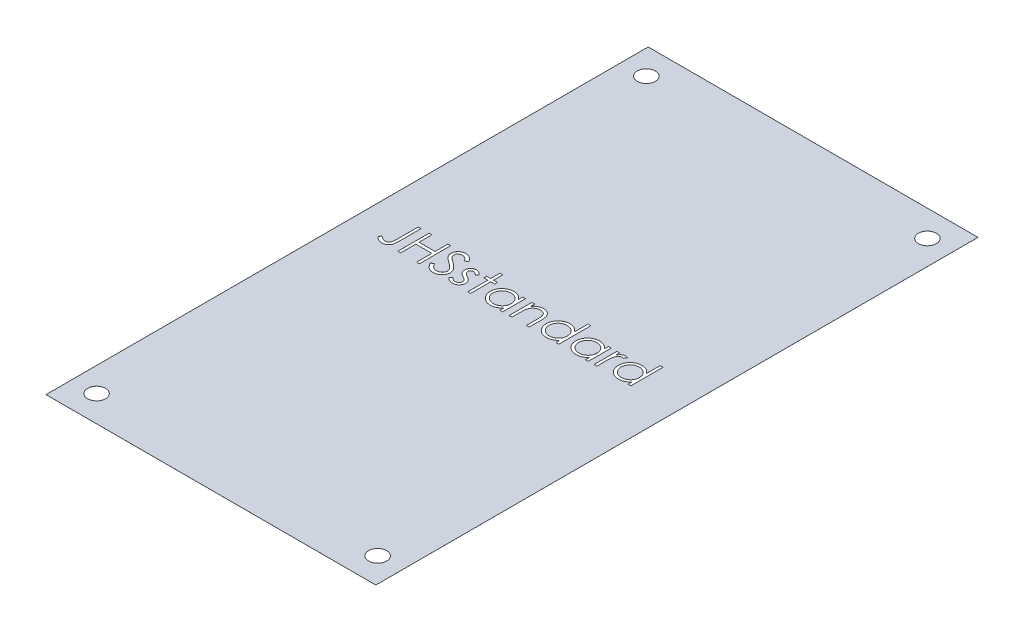
from build123d import *

# Parameters (mm, degrees)
SKETCH2_W           = 67.056
SKETCH2_H           = 122.428
BOSS_EXTRUDE1_DEPTH = 0.00254
SKETCH3_R           = 1.8288
CUT_EXTRUDE1_DEPTH  = 70.794559863
CUT_EXTRUDE2_DEPTH  = 2.54


with BuildPart() as part:
    # Sketch2 → Boss-Extrude1 (new body)
    with BuildSketch(Plane(origin=(0, 0, 0), x_dir=(1, 0, 0), z_dir=(0, 1, 0))):
        Rectangle(SKETCH2_W, SKETCH2_H)
    extrude(amount=BOSS_EXTRUDE1_DEPTH)

    # Sketch3 → Cut-Extrude1 (cut, through all)
    with BuildSketch(Plane(origin=(0, 0.00254, 0), x_dir=(1, 0, 0), z_dir=(0, 1, 0))):
        with Locations(Location((-28.575, 55.88, 0), (0, 0, 270))):
            Circle(SKETCH3_R)
        with Locations(Location((28.575, 55.88, 0), (0, 0, 270))):
            Circle(SKETCH3_R)
        with Locations(Location((28.575, -55.88, 0), (0, 0, 270))):
            Circle(SKETCH3_R)
        with Locations(Location((-28.575, -55.88, 0), (0, 0, 270))):
            Circle(SKETCH3_R)
    extrude(amount=-CUT_EXTRUDE1_DEPTH, mode=Mode.SUBTRACT)

    # Sketch5 → Cut-Extrude2 (cut)
    # profile 1 of 11: a face of its own
    with BuildSketch(Plane(origin=(0, 0.00254, 0), x_dir=(1, 0, 0), z_dir=(0, 1, 0))):
        with BuildLine():
            Line((-25.204522376, 6.142447779), (-24.634650581, 6.142447779))
            Line((-24.634650581, 6.142447779), (-24.634650581, 1.854416929))
            add(Edge.make_bspline(
                [(-24.634650581, 1.854416929), (-24.635220119, 1.775123262), (-24.636313702, 1.622869745), (-24.64232699, 1.403569963), (-24.653454871, 1.203326004), (-24.669665536, 1.021682535), (-24.691292245, 0.859208614), (-24.716040967, 0.714648836), (-24.745999902, 0.589209698), (-24.791114777, 0.448356981), (-24.865090369, 0.293881792), (-24.97642771, 0.127048876), (-25.114735783, -0.018880312), (-25.274939086, -0.145613113), (-25.458437801, -0.246591232), (-25.661453142, -0.319081341), (-25.882735379, -0.363297038), (-26.036222521, -0.367966838), (-26.11529962, -0.370372734)],
                knots=[0, 0, 0, 0, 1.237770943, 2.376671248, 3.424123796, 4.367912054, 5.222547132, 5.982086412, 6.656319012, 7.234008312, 8.288027371, 9.317870876, 10.352700517, 11.413286737, 12.494591526, 13.606319346, 14.766767577, 16, 16, 16, 16], degree=3))
            add(Edge.make_bspline(
                [(-26.11529962, -0.370372734), (-26.176909784, -0.3684122), (-26.300873515, -0.364467477), (-26.485369515, -0.332315226), (-26.669341671, -0.282756119), (-26.853766443, -0.210179981), (-27.042287495, -0.111472681), (-27.237458096, 0.017676915), (-27.441788742, 0.177028398), (-27.576378418, 0.298654022), (-27.646830068, 0.362319574)],
                knots=[0, 0, 0, 0, 0.848567217, 1.707373443, 2.573483905, 3.470863513, 4.432650262, 5.500696352, 6.691726801, 8, 8, 8, 8], degree=3))
            Line((-27.646830068, 0.362319574), (-27.311012761, 0.850781112))
            add(Edge.make_bspline(
                [(-27.311012761, 0.850781112), (-27.2335379, 0.797355122), (-27.087255261, 0.696479886), (-26.872254347, 0.566710197), (-26.681759513, 0.455448825), (-26.557149022, 0.398748261), (-26.499454267, 0.372495856)],
                knots=[0, 0, 0, 0, 1.196737151, 2.259595785, 3.194191475, 4, 4, 4, 4], degree=3))
            add(Edge.make_bspline(
                [(-26.499454267, 0.372495856), (-26.464467016, 0.35878084), (-26.395849226, 0.331882641), (-26.29093801, 0.301863654), (-26.186625586, 0.285458139), (-26.117469198, 0.28240772), (-26.083498738, 0.280909317)],
                knots=[0, 0, 0, 0, 1.051806502, 2.062826769, 3.048436908, 4, 4, 4, 4], degree=3))
            add(Edge.make_bspline(
                [(-26.083498738, 0.280909317), (-26.039624251, 0.282764851), (-25.952900566, 0.286432556), (-25.826873034, 0.318816241), (-25.706299177, 0.368245372), (-25.59550137, 0.440619577), (-25.493383596, 0.526673726), (-25.409123041, 0.630733913), (-25.338878897, 0.746060769), (-25.296606597, 0.855228979), (-25.269673939, 0.954790865), (-25.252580416, 1.046290983), (-25.237633132, 1.153263951), (-25.224603745, 1.275837457), (-25.216975634, 1.414256902), (-25.208417153, 1.568115847), (-25.205323323, 1.737802202), (-25.204797505, 1.8561135), (-25.204522376, 1.918018692)],
                knots=[0, 0, 0, 0, 0.997221856, 1.971139923, 2.944579524, 3.951425367, 4.971190333, 5.972282193, 6.985401279, 8.033996657, 8.624075553, 9.332086008, 10.151144245, 11.082816738, 12.137127781, 13.306538797, 14.590673636, 16, 16, 16, 16], degree=3))
            Line((-25.204522376, 1.918018692), (-25.204522376, 6.142447779))
        make_face()
    # profile 2 of 11: a face of its own
    with BuildSketch(Plane(origin=(0, 0.00254, 0), x_dir=(1, 0, 0), z_dir=(0, 1, 0))):
        Polygon((-23.006445453, 6.142447779), (-22.436573658, 6.142447779), (-22.436573658, 3.537319574), (-19.180163402, 3.537319574), (-19.180163402, 6.142447779), (-18.610291607, 6.142447779), (-18.610291607, -0.207552221), (-19.180163402, -0.207552221), (-19.180163402, 2.886037522), (-22.436573658, 2.886037522), (-22.436573658, -0.207552221), (-23.006445453, -0.207552221), align=None)
    # profile 3 of 11: a face of its own
    with BuildSketch(Plane(origin=(0, 0.00254, 0), x_dir=(1, 0, 0), z_dir=(0, 1, 0))):
        with BuildLine():
            Line((-17.63336853, 1.017417731), (-17.096569652, 1.33924265))
            add(Edge.make_bspline(
                [(-17.096569652, 1.33924265), (-17.046643707, 1.255668695), (-16.950987524, 1.095544221), (-16.791418629, 0.879176062), (-16.62607749, 0.695276149), (-16.453739699, 0.544914304), (-16.275457194, 0.426534181), (-16.090066125, 0.342710132), (-15.898191239, 0.29042972), (-15.767610163, 0.284079563), (-15.702419011, 0.280909317)],
                knots=[0, 0, 0, 0, 1.272034388, 2.437168799, 3.508375237, 4.49857839, 5.41946034, 6.295179144, 7.148887113, 8, 8, 8, 8], degree=3))
            add(Edge.make_bspline(
                [(-15.702419011, 0.280909317), (-15.646744278, 0.282459937), (-15.53636899, 0.285534045), (-15.373877492, 0.315072072), (-15.216067651, 0.36045122), (-15.066191979, 0.425440624), (-14.926318507, 0.50406902), (-14.803660646, 0.599039942), (-14.697622697, 0.705368344), (-14.610883304, 0.82399116), (-14.54433524, 0.951566558), (-14.493186773, 1.082514356), (-14.464802139, 1.218891615), (-14.460526315, 1.310713455), (-14.45836853, 1.357051144)],
                knots=[0, 0, 0, 0, 1.095163259, 2.171163733, 3.241058638, 4.321873601, 5.38011039, 6.391990106, 7.366004449, 8.327778327, 9.272591725, 10.192022065, 11.087607919, 12, 12, 12, 12], degree=3))
            add(Edge.make_bspline(
                [(-14.45836853, 1.357051144), (-14.461043351, 1.409920971), (-14.466480871, 1.517397605), (-14.512439413, 1.675965546), (-14.584737332, 1.832887781), (-14.651435272, 1.929954362), (-14.686062841, 1.98034842)],
                knots=[0, 0, 0, 0, 0.938893495, 1.908633276, 2.914225137, 4, 4, 4, 4], degree=3))
            add(Edge.make_bspline(
                [(-14.686062841, 1.98034842), (-14.714493812, 2.016719085), (-14.77418108, 2.093074748), (-14.876792568, 2.206731104), (-14.997199661, 2.323967379), (-15.131281825, 2.449260239), (-15.283923286, 2.576782385), (-15.450343205, 2.712614832), (-15.634790492, 2.851591979), (-15.76414815, 2.94479649), (-15.830894572, 2.992888484)],
                knots=[0, 0, 0, 0, 0.722233717, 1.516239348, 2.393582979, 3.351407094, 4.387010283, 5.505090956, 6.712668013, 8, 8, 8, 8], degree=3))
            add(Edge.make_bspline(
                [(-15.830894572, 2.992888484), (-15.897703822, 3.040474636), (-16.025438021, 3.131455734), (-16.20407002, 3.26648265), (-16.363807832, 3.38993367), (-16.503941476, 3.502970949), (-16.624409316, 3.605609818), (-16.726160647, 3.69686465), (-16.806603458, 3.779203396), (-16.851335726, 3.832618402), (-16.871419411, 3.856600423)],
                knots=[0, 0, 0, 0, 1.452282411, 2.77665338, 3.964542531, 5.026858415, 5.96415736, 6.766646006, 7.446254459, 8, 8, 8, 8], degree=3))
            add(Edge.make_bspline(
                [(-16.871419411, 3.856600423), (-16.899491029, 3.89397659), (-16.954697633, 3.967481838), (-17.027570243, 4.082371223), (-17.089508438, 4.199979147), (-17.138062955, 4.320621644), (-17.178950095, 4.442605015), (-17.206450912, 4.567520847), (-17.223671018, 4.694808626), (-17.225434479, 4.780467406), (-17.226317248, 4.823347218)],
                knots=[0, 0, 0, 0, 1.068054152, 2.10047183, 3.106115577, 4.101338837, 5.06977816, 6.043150881, 7.020423561, 8, 8, 8, 8], degree=3))
            add(Edge.make_bspline(
                [(-17.226317248, 4.823347218), (-17.223949226, 4.890529809), (-17.219263797, 5.02345901), (-17.179638858, 5.217643517), (-17.11709518, 5.403038874), (-17.029474454, 5.577809622), (-16.916521828, 5.737405045), (-16.785809846, 5.883660942), (-16.630123293, 6.006612513), (-16.459303533, 6.114040105), (-16.27232983, 6.198124855), (-16.076403477, 6.261554061), (-15.871213074, 6.297493715), (-15.732233102, 6.302651302), (-15.661713882, 6.305268291)],
                knots=[0, 0, 0, 0, 1.005424448, 1.989358655, 2.955360095, 3.929531133, 4.905563448, 5.876582895, 6.856512386, 7.866279853, 8.892233794, 9.918561126, 10.94386622, 12, 12, 12, 12], degree=3))
            add(Edge.make_bspline(
                [(-15.661713882, 6.305268291), (-15.586885301, 6.302687376), (-15.438075134, 6.29755476), (-15.219182986, 6.25292781), (-15.008434257, 6.179085163), (-14.838901477, 6.095285741), (-14.706217752, 6.011590172), (-14.60503008, 5.935354205), (-14.502491277, 5.847587937), (-14.397774234, 5.74805759), (-14.292653324, 5.635849913), (-14.185567917, 5.511733378), (-14.076267601, 5.376466484), (-14.005953398, 5.279902032), (-13.969906991, 5.2303985)],
                knots=[0, 0, 0, 0, 1.286793592, 2.559021753, 3.825965368, 5.121522368, 5.803751409, 6.523245864, 7.299691795, 8.125521123, 9.008227632, 9.944561021, 10.946284179, 12, 12, 12, 12], degree=3))
            Line((-13.969906991, 5.2303985), (-14.48508127, 4.839883676))
            add(Edge.make_bspline(
                [(-14.48508127, 4.839883676), (-14.516188891, 4.879958872), (-14.576094894, 4.957134328), (-14.667044106, 5.065213715), (-14.752766653, 5.163940756), (-14.837222378, 5.249693203), (-14.915950824, 5.327167074), (-14.992363172, 5.393496918), (-15.065359781, 5.449332641), (-15.157374747, 5.508920243), (-15.272976893, 5.567987042), (-15.418091695, 5.617968941), (-15.569741079, 5.648004553), (-15.673027697, 5.651975821), (-15.725315645, 5.65398624)],
                knots=[0, 0, 0, 0, 1.181633172, 2.275549214, 3.290209073, 4.226197932, 5.078386478, 5.862611352, 6.581680152, 7.217281963, 8.414376989, 9.595101626, 10.782541182, 12, 12, 12, 12], degree=3))
            add(Edge.make_bspline(
                [(-15.725315645, 5.65398624), (-15.790913907, 5.65178787), (-15.917413976, 5.647548521), (-16.097010547, 5.601247976), (-16.258652383, 5.528346601), (-16.397540608, 5.426175141), (-16.513177695, 5.305124197), (-16.59682617, 5.165825417), (-16.647172897, 5.012005915), (-16.653316576, 4.904706053), (-16.656445453, 4.850059958)],
                knots=[0, 0, 0, 0, 1.14458467, 2.207223713, 3.21896685, 4.227309161, 5.202851033, 6.127160689, 7.046193047, 8, 8, 8, 8], degree=3))
            add(Edge.make_bspline(
                [(-16.656445453, 4.850059958), (-16.655732209, 4.816039419), (-16.654304555, 4.747942709), (-16.634393136, 4.647337986), (-16.608812925, 4.546987413), (-16.568277007, 4.447342156), (-16.512314814, 4.346659533), (-16.438826852, 4.243205809), (-16.346274128, 4.136069138), (-16.275377263, 4.066387188), (-16.237945854, 4.029597218)],
                knots=[0, 0, 0, 0, 0.858281714, 1.717966888, 2.583508476, 3.4729293, 4.427298488, 5.488583878, 6.674047936, 8, 8, 8, 8], degree=3))
            add(Edge.make_bspline(
                [(-16.237945854, 4.029597218), (-16.224045935, 4.0171929), (-16.19102291, 3.987723079), (-16.130650874, 3.939477084), (-16.050926083, 3.879963483), (-15.953930375, 3.806326494), (-15.837875304, 3.72090727), (-15.70274811, 3.624798002), (-15.550055043, 3.514878669), (-15.441702424, 3.438029989), (-15.384410197, 3.397395695)],
                knots=[0, 0, 0, 0, 0.420754252, 0.999615792, 1.744751191, 2.668019286, 3.750313428, 4.999500688, 6.413464383, 8, 8, 8, 8], degree=3))
            add(Edge.make_bspline(
                [(-15.384410197, 3.397395695), (-15.315492897, 3.347246372), (-15.182044097, 3.250139157), (-14.992165345, 3.104242137), (-14.820000865, 2.961552614), (-14.664946195, 2.822981813), (-14.525469519, 2.689580844), (-14.403118225, 2.559744788), (-14.296645634, 2.434403821), (-14.18202048, 2.273707862), (-14.064894151, 2.076347895), (-13.964307416, 1.834543091), (-13.900882986, 1.591798338), (-13.89258895, 1.428645363), (-13.888496735, 1.348146897)],
                knots=[0, 0, 0, 0, 1.163667725, 2.253281268, 3.268753668, 4.215851969, 5.092017293, 5.902905408, 6.650798638, 7.335211899, 8.59617414, 9.77448103, 10.901945474, 12, 12, 12, 12], degree=3))
            add(Edge.make_bspline(
                [(-13.888496735, 1.348146897), (-13.889688971, 1.291217578), (-13.892050292, 1.178464468), (-13.919193664, 1.012901685), (-13.958962199, 0.852099965), (-14.018901181, 0.698046946), (-14.092058911, 0.547924305), (-14.184889103, 0.405669972), (-14.292490188, 0.268135506), (-14.415922876, 0.138988314), (-14.550989013, 0.020431644), (-14.693743716, -0.085031081), (-14.84442064, -0.172966468), (-15.002202386, -0.244722996), (-15.167125197, -0.300845235), (-15.339133605, -0.341508583), (-15.518511147, -0.366465373), (-15.64043202, -0.36905574), (-15.702419011, -0.370372734)],
                knots=[0, 0, 0, 0, 0.983748083, 1.948392443, 2.894712957, 3.844097841, 4.80183111, 5.778335162, 6.776009319, 7.81870978, 8.863265674, 9.881300176, 10.883814829, 11.87499822, 12.874611388, 13.892143829, 14.928324115, 16, 16, 16, 16], degree=3))
            add(Edge.make_bspline(
                [(-15.702419011, -0.370372734), (-15.750380276, -0.369445305), (-15.845698783, -0.367602126), (-15.986685986, -0.351307517), (-16.124824955, -0.3282532), (-16.258382295, -0.291651674), (-16.389078742, -0.247243444), (-16.516345868, -0.192563897), (-16.640245351, -0.127036975), (-16.761471537, -0.052116002), (-16.879716111, 0.035074478), (-16.993870003, 0.136626393), (-17.107678668, 0.249738952), (-17.217782944, 0.377483831), (-17.326409935, 0.51779721), (-17.431417906, 0.671991871), (-17.534980451, 0.839227927), (-17.599959943, 0.956911726), (-17.63336853, 1.017417731)],
                knots=[0, 0, 0, 0, 0.915332311, 1.819136955, 2.706846663, 3.586547465, 4.459518054, 5.340707479, 6.227863349, 7.133153174, 8.059268498, 9.028702269, 10.047606654, 11.120612155, 12.245963614, 13.433783089, 14.680604001, 16, 16, 16, 16], degree=3))
        make_face()
    # profile 4 of 11: a face of its own
    with BuildSketch(Plane(origin=(0, 0.00254, 0), x_dir=(1, 0, 0), z_dir=(0, 1, 0))):
        with BuildLine():
            Line((-10.550676222, 3.854056352), (-10.93737494, 3.455909317))
            add(Edge.make_bspline(
                [(-10.93737494, 3.455909317), (-10.970740568, 3.494577454), (-11.035065571, 3.56912507), (-11.137085543, 3.668796605), (-11.238728367, 3.752502194), (-11.338602643, 3.823172721), (-11.439219788, 3.876601887), (-11.539399054, 3.915599708), (-11.639244165, 3.939732984), (-11.705984543, 3.942843465), (-11.738757152, 3.944370856)],
                knots=[0, 0, 0, 0, 1.26578478, 2.440284043, 3.530471711, 4.527705817, 5.468200915, 6.346673037, 7.188140097, 8, 8, 8, 8], degree=3))
            add(Edge.make_bspline(
                [(-11.738757152, 3.944370856), (-11.77892433, 3.942420729), (-11.857967653, 3.938583156), (-11.971225924, 3.900277361), (-12.076364915, 3.841478649), (-12.167364007, 3.758078505), (-12.244448798, 3.662349046), (-12.300716477, 3.555312856), (-12.33512619, 3.440199977), (-12.339489061, 3.360317235), (-12.341701863, 3.319801545)],
                knots=[0, 0, 0, 0, 0.99966794, 1.967205029, 2.953328237, 3.988086729, 5.028030931, 6.008226631, 6.989793394, 8, 8, 8, 8], degree=3))
            add(Edge.make_bspline(
                [(-12.341701863, 3.319801545), (-12.339686532, 3.283131122), (-12.335661552, 3.209893649), (-12.304371148, 3.101856502), (-12.254539846, 2.996524447), (-12.207966779, 2.932003174), (-12.183969491, 2.898757875)],
                knots=[0, 0, 0, 0, 0.960159726, 1.917612774, 2.927026955, 4, 4, 4, 4], degree=3))
            add(Edge.make_bspline(
                [(-12.183969491, 2.898757875), (-12.169521438, 2.881005843), (-12.138770579, 2.843222881), (-12.081060844, 2.790783033), (-12.015705732, 2.732830663), (-11.937110988, 2.674888116), (-11.848662694, 2.613870558), (-11.74844285, 2.552180974), (-11.639631963, 2.485116946), (-11.561731421, 2.442582041), (-11.521239123, 2.420472618)],
                knots=[0, 0, 0, 0, 0.66740084, 1.420478572, 2.27185888, 3.217733974, 4.268547843, 5.408967954, 6.65319498, 8, 8, 8, 8], degree=3))
            add(Edge.make_bspline(
                [(-11.521239123, 2.420472618), (-11.471865919, 2.392814009), (-11.376493146, 2.339386683), (-11.240979125, 2.256456221), (-11.117994065, 2.174030637), (-11.006495925, 2.09299144), (-10.908630072, 2.011071237), (-10.821427241, 1.931410021), (-10.747062493, 1.851600848), (-10.705417511, 1.795842198), (-10.685511959, 1.769190567)],
                knots=[0, 0, 0, 0, 1.27191281, 2.456916733, 3.569705269, 4.599008579, 5.553216877, 6.436649441, 7.252746552, 8, 8, 8, 8], degree=3))
            add(Edge.make_bspline(
                [(-10.685511959, 1.769190567), (-10.65247286, 1.715367807), (-10.586718919, 1.608250526), (-10.51767035, 1.431868522), (-10.477646709, 1.244796611), (-10.472090966, 1.116831011), (-10.469265966, 1.051762683)],
                knots=[0, 0, 0, 0, 0.995354457, 1.980940102, 2.973342416, 4, 4, 4, 4], degree=3))
            add(Edge.make_bspline(
                [(-10.469265966, 1.051762683), (-10.470571406, 1.005917231), (-10.473143918, 0.915573762), (-10.491029268, 0.782523428), (-10.521790439, 0.655279302), (-10.563689107, 0.532460714), (-10.620266469, 0.416420924), (-10.686574615, 0.304232301), (-10.766176241, 0.198321683), (-10.857056308, 0.098828141), (-10.956561704, 0.007958285), (-11.062708555, -0.071913745), (-11.175627577, -0.138270043), (-11.294511916, -0.193180026), (-11.419631689, -0.236846723), (-11.551006457, -0.267077315), (-11.688218626, -0.285170753), (-11.781526992, -0.287682589), (-11.829071655, -0.288962478)],
                knots=[0, 0, 0, 0, 1.032770009, 2.035186124, 3.017557409, 3.978232242, 4.952395191, 5.920591857, 6.910227898, 7.931268572, 8.952309245, 9.941945286, 10.918353717, 11.897095711, 12.887975737, 13.898235213, 14.929059601, 16, 16, 16, 16], degree=3))
            add(Edge.make_bspline(
                [(-11.829071655, -0.288962478), (-11.893237816, -0.287161436), (-12.020678555, -0.283584377), (-12.209164188, -0.250009095), (-12.39335185, -0.197766023), (-12.571847702, -0.125709971), (-12.740659937, -0.034722249), (-12.895111758, 0.074248094), (-13.035739697, 0.197601375), (-13.11578285, 0.292149084), (-13.155804427, 0.339422939)],
                knots=[0, 0, 0, 0, 1.013940152, 2.01379169, 3.017749504, 4.037548394, 5.051665909, 6.043208538, 7.021604269, 8, 8, 8, 8], degree=3))
            Line((-13.155804427, 0.339422939), (-12.778009956, 0.769370856))
            add(Edge.make_bspline(
                [(-12.778009956, 0.769370856), (-12.74213715, 0.730627211), (-12.672592291, 0.655516799), (-12.561374369, 0.555505495), (-12.448200312, 0.471683189), (-12.334200238, 0.401572994), (-12.217686638, 0.347551905), (-12.099312453, 0.309599599), (-11.979318455, 0.285207993), (-11.898724008, 0.282344538), (-11.858328466, 0.280909317)],
                knots=[0, 0, 0, 0, 1.179806542, 2.287233372, 3.337373186, 4.324005949, 5.273901747, 6.200048787, 7.097828587, 8, 8, 8, 8], degree=3))
            add(Edge.make_bspline(
                [(-11.858328466, 0.280909317), (-11.803323086, 0.283396385), (-11.6958518, 0.288255699), (-11.541920981, 0.332373851), (-11.39979233, 0.401552478), (-11.276378546, 0.499677573), (-11.171327483, 0.613896969), (-11.095257795, 0.742555443), (-11.047585305, 0.881877086), (-11.041986422, 0.978455692), (-11.039137761, 1.027594013)],
                knots=[0, 0, 0, 0, 1.072336372, 2.095165389, 3.102688358, 4.141489647, 5.156069229, 6.117746104, 7.042326257, 8, 8, 8, 8], degree=3))
            add(Edge.make_bspline(
                [(-11.039137761, 1.027594013), (-11.041108609, 1.068070035), (-11.044999785, 1.147984523), (-11.075558293, 1.263645856), (-11.123841611, 1.373354408), (-11.17138433, 1.43756134), (-11.195598097, 1.470262282)],
                knots=[0, 0, 0, 0, 1.013901739, 2.00181326, 2.98231254, 4, 4, 4, 4], degree=3))
            add(Edge.make_bspline(
                [(-11.195598097, 1.470262282), (-11.210153013, 1.48665501), (-11.241858876, 1.522364293), (-11.300016242, 1.573935508), (-11.369651906, 1.629521774), (-11.451549059, 1.688180513), (-11.545872797, 1.749137983), (-11.653005417, 1.812074379), (-11.771479276, 1.879978968), (-11.855245993, 1.925008914), (-11.899033594, 1.948547538)],
                knots=[0, 0, 0, 0, 0.615000592, 1.339693406, 2.178160186, 3.116406724, 4.166410947, 5.330106347, 6.604359322, 8, 8, 8, 8], degree=3))
            add(Edge.make_bspline(
                [(-11.899033594, 1.948547538), (-11.946289641, 1.974925677), (-12.037934197, 2.026081307), (-12.167741425, 2.105757624), (-12.284848768, 2.186796822), (-12.392074096, 2.264652973), (-12.486709063, 2.343430972), (-12.568380855, 2.423218271), (-12.640304975, 2.500797103), (-12.680123851, 2.555765055), (-12.69914377, 2.582021096)],
                knots=[0, 0, 0, 0, 1.262093308, 2.447601706, 3.550203992, 4.582594899, 5.537233252, 6.418365656, 7.244515135, 8, 8, 8, 8], degree=3))
            add(Edge.make_bspline(
                [(-12.69914377, 2.582021096), (-12.732037858, 2.634899569), (-12.797837529, 2.740674994), (-12.861727948, 2.917224002), (-12.9056446, 3.103088606), (-12.909567794, 3.231334756), (-12.911573658, 3.29690491)],
                knots=[0, 0, 0, 0, 0.985009483, 1.970363186, 2.962279964, 4, 4, 4, 4], degree=3))
            add(Edge.make_bspline(
                [(-12.911573658, 3.29690491), (-12.910604475, 3.339768132), (-12.908707647, 3.42365753), (-12.893569153, 3.546917961), (-12.866007049, 3.664026755), (-12.831435975, 3.776742635), (-12.783388238, 3.882882148), (-12.725973525, 3.983860703), (-12.658504911, 4.079538726), (-12.58077494, 4.168444408), (-12.495310027, 4.249197043), (-12.402972373, 4.319588839), (-12.305838679, 4.379653226), (-12.203497689, 4.43002716), (-12.09496626, 4.468129669), (-11.981003016, 4.494359496), (-11.861838635, 4.511876792), (-11.780375164, 4.513442674), (-11.738757152, 4.51424265)],
                knots=[0, 0, 0, 0, 1.087655834, 2.128696564, 3.144119009, 4.137814668, 5.115653402, 6.093965665, 7.082169637, 8.081268856, 9.086088321, 10.061021666, 11.022561449, 11.980240094, 12.950172527, 13.934149372, 14.944599409, 16, 16, 16, 16], degree=3))
            add(Edge.make_bspline(
                [(-11.738757152, 4.51424265), (-11.689422979, 4.512239061), (-11.589829177, 4.508194297), (-11.440414355, 4.476071115), (-11.291219578, 4.42321534), (-11.1418615, 4.350215317), (-10.993434261, 4.255751128), (-10.844632249, 4.141579399), (-10.693669108, 4.00845126), (-10.599405512, 3.906671237), (-10.550676222, 3.854056352)],
                knots=[0, 0, 0, 0, 0.845714091, 1.707292901, 2.609013841, 3.555613372, 4.552488639, 5.621697636, 6.770543573, 8, 8, 8, 8], degree=3))
        make_face()
    # profile 5 of 11: a face of its own
    with BuildSketch(Plane(origin=(0, 0.00254, 0), x_dir=(1, 0, 0), z_dir=(0, 1, 0))):
        Polygon((-8.759650581, 6.305268291), (-8.189778786, 6.305268291), (-8.189778786, 4.432832394), (-7.375676222, 4.432832394), (-7.375676222, 3.862960599), (-8.189778786, 3.862960599), (-8.189778786, -0.207552221), (-8.759650581, -0.207552221), (-8.759650581, 3.862960599), (-9.573753145, 3.862960599), (-9.573753145, 4.432832394), (-8.759650581, 4.432832394), align=None)
    # profile 6 of 11: a face of its own
    with BuildSketch(Plane(origin=(0, 0.00254, 0), x_dir=(1, 0, 0), z_dir=(0, 1, 0))):
        with BuildLine():
            Line((-1.676958274, 4.432832394), (-1.676958274, -0.207552221))
            Line((-1.676958274, -0.207552221), (-2.246830068, -0.207552221))
            Line((-2.246830068, -0.207552221), (-2.246830068, 0.595102025))
            add(Edge.make_bspline(
                [(-2.246830068, 0.595102025), (-2.311089874, 0.522458762), (-2.436493693, 0.38069452), (-2.645936865, 0.195488293), (-2.867947702, 0.04240191), (-3.10144867, -0.081241509), (-3.346228911, -0.174118525), (-3.601745813, -0.240133414), (-3.868103604, -0.282576515), (-4.049990019, -0.286814726), (-4.1421626, -0.288962478)],
                knots=[0, 0, 0, 0, 1.074387032, 2.096679803, 3.090159297, 4.057316773, 5.018401886, 5.985159533, 6.978961417, 8, 8, 8, 8], degree=3))
            add(Edge.make_bspline(
                [(-4.1421626, -0.288962478), (-4.224110174, -0.286737488), (-4.385714417, -0.28234971), (-4.6234386, -0.24830953), (-4.852205967, -0.193643974), (-5.072232691, -0.117623789), (-5.282095012, -0.016784298), (-5.483589759, 0.103940538), (-5.675673072, 0.247706044), (-5.85541715, 0.412058609), (-6.020938065, 0.590575229), (-6.166192088, 0.780976435), (-6.287301247, 0.982438901), (-6.388574822, 1.192411909), (-6.466582475, 1.412511834), (-6.520963212, 1.641977553), (-6.554963737, 1.880537752), (-6.559349701, 2.04298803), (-6.561573658, 2.125360439)],
                knots=[0, 0, 0, 0, 1.033919861, 2.038935746, 3.024066025, 3.998881131, 4.97069526, 5.957263378, 6.95902576, 7.993208707, 9.027059324, 10.027763471, 11.009749337, 11.988697705, 12.965288445, 13.950418724, 14.960734635, 16, 16, 16, 16], degree=3))
            add(Edge.make_bspline(
                [(-6.561573658, 2.125360439), (-6.55930041, 2.206030301), (-6.554806321, 2.365510267), (-6.521326908, 2.600058762), (-6.465027792, 2.825970463), (-6.386019554, 3.04251806), (-6.284706293, 3.24996358), (-6.161465335, 3.44845374), (-6.016287781, 3.638535361), (-5.848915556, 3.815738872), (-5.667605331, 3.979424844), (-5.473642347, 4.121681255), (-5.271851537, 4.244538966), (-5.059102932, 4.341881702), (-4.838545471, 4.42063822), (-4.608215648, 4.475126605), (-4.369071783, 4.507234602), (-4.206710462, 4.511884189), (-4.124354107, 4.51424265)],
                knots=[0, 0, 0, 0, 1.020392517, 2.01726096, 2.990465484, 3.961182959, 4.928053699, 5.906110375, 6.912531644, 7.948652711, 8.985773172, 9.998621852, 10.987621588, 11.969261332, 12.953316658, 13.946091881, 14.958173133, 16, 16, 16, 16], degree=3))
            add(Edge.make_bspline(
                [(-4.124354107, 4.51424265), (-4.029648648, 4.511634158), (-3.843935714, 4.506519029), (-3.572286325, 4.463950938), (-3.315302773, 4.392035433), (-3.071001305, 4.294213686), (-2.840259204, 4.164222421), (-2.625260932, 4.000247349), (-2.423756412, 3.803322624), (-2.306952169, 3.652064817), (-2.246830068, 3.574208596)],
                knots=[0, 0, 0, 0, 1.038897134, 2.037228247, 3.008116434, 3.962042015, 4.918381754, 5.904844433, 6.921570401, 8, 8, 8, 8], degree=3))
            Line((-2.246830068, 3.574208596), (-2.246830068, 4.432832394))
            Line((-2.246830068, 4.432832394), (-1.676958274, 4.432832394))
        make_face()
        with BuildLine():
            add(Edge.make_bspline(
                [(-4.116721895, 3.944370856), (-4.200023623, 3.94140697), (-4.364447983, 3.935556731), (-4.605827815, 3.889884819), (-4.836810723, 3.813894197), (-5.056241458, 3.709968462), (-5.260653794, 3.579287755), (-5.443340882, 3.421224673), (-5.605796926, 3.240091805), (-5.742427634, 3.036706547), (-5.853807536, 2.818669154), (-5.932124865, 2.59075053), (-5.983776214, 2.3570615), (-5.989053101, 2.198560627), (-5.991701863, 2.119000263)],
                knots=[0, 0, 0, 0, 1.031046209, 2.035121221, 3.029706178, 4.034933723, 5.034054252, 6.02443088, 7.017295772, 8.038157696, 9.050218397, 10.03989886, 11.016116709, 12, 12, 12, 12], degree=3))
            add(Edge.make_bspline(
                [(-5.991701863, 2.119000263), (-5.988318414, 2.039915354), (-5.981564777, 1.882055523), (-5.933031375, 1.648047905), (-5.851606461, 1.420075571), (-5.740495862, 1.200073483), (-5.601364414, 0.995813758), (-5.440095002, 0.811228107), (-5.255128063, 0.652496997), (-5.0502453, 0.519623113), (-4.831427982, 0.412285397), (-4.601314992, 0.337599165), (-4.364232049, 0.289379478), (-4.203028529, 0.28374707), (-4.121810036, 0.280909317)],
                knots=[0, 0, 0, 0, 0.979072187, 1.954306742, 2.945804271, 3.96968567, 4.997920485, 5.998718438, 6.996577872, 8.005894225, 9.015743152, 10.005417472, 10.995077863, 12, 12, 12, 12], degree=3))
            add(Edge.make_bspline(
                [(-4.121810036, 0.280909317), (-4.039357096, 0.283920966), (-3.875366374, 0.289910837), (-3.633270433, 0.335778275), (-3.398329572, 0.411558809), (-3.173744172, 0.516604368), (-2.964527762, 0.646792714), (-2.776753042, 0.799205579), (-2.61797407, 0.97646707), (-2.483367479, 1.171278635), (-2.377820651, 1.384841828), (-2.300938372, 1.61223386), (-2.255483429, 1.853462646), (-2.249754405, 2.018315771), (-2.246830068, 2.102463804)],
                knots=[0, 0, 0, 0, 1.01762866, 2.023962475, 3.030623092, 4.058876274, 5.077231937, 6.066672613, 7.034107872, 8.005628644, 8.981990164, 9.965428785, 10.961468474, 12, 12, 12, 12], degree=3))
            add(Edge.make_bspline(
                [(-2.246830068, 2.102463804), (-2.248571159, 2.166576725), (-2.251998177, 2.292771243), (-2.278179353, 2.478059739), (-2.319826148, 2.655376642), (-2.378511342, 2.824908378), (-2.455602673, 2.98571762), (-2.548580762, 3.138959014), (-2.65908065, 3.283835554), (-2.785323541, 3.418352269), (-2.92350898, 3.541045993), (-3.069730504, 3.650563973), (-3.225720516, 3.740532175), (-3.388855712, 3.814992767), (-3.559419133, 3.874245796), (-3.738798686, 3.913774898), (-3.925087705, 3.940917195), (-4.052171263, 3.943207514), (-4.116721895, 3.944370856)],
                knots=[0, 0, 0, 0, 1.050140795, 2.067009409, 3.05949893, 4.030605086, 5.00011959, 5.97591094, 6.962425594, 7.979863591, 8.993523472, 9.986985069, 10.967611495, 11.937549037, 12.921786183, 13.919465291, 14.943216303, 16, 16, 16, 16], degree=3))
        make_face(mode=Mode.SUBTRACT)
    # profile 7 of 11: a face of its own
    with BuildSketch(Plane(origin=(0, 0.00254, 0), x_dir=(1, 0, 0), z_dir=(0, 1, 0))):
        with BuildLine():
            Line((-0.374394171, 4.432832394), (0.195477624, 4.432832394))
            Line((0.195477624, 4.432832394), (0.195477624, 3.595833195))
            add(Edge.make_bspline(
                [(0.195477624, 3.595833195), (0.256324476, 3.67174785), (0.374399916, 3.819062885), (0.571040064, 4.012684499), (0.778855426, 4.172242264), (0.996573346, 4.299430576), (1.224489379, 4.395309455), (1.46121424, 4.464553358), (1.708165207, 4.506072976), (1.876103542, 4.511498108), (1.96106256, 4.51424265)],
                knots=[0, 0, 0, 0, 1.12780773, 2.188550248, 3.19190651, 4.159438251, 5.104880172, 6.052711206, 7.014878035, 8, 8, 8, 8], degree=3))
            add(Edge.make_bspline(
                [(1.96106256, 4.51424265), (2.046933853, 4.511076367), (2.215004688, 4.504879187), (2.459712027, 4.455863191), (2.688263756, 4.372142514), (2.89984495, 4.257457757), (3.090575751, 4.114843155), (3.258079411, 3.948694894), (3.396624159, 3.757585143), (3.489510804, 3.580287417), (3.550698764, 3.423009176), (3.589220291, 3.288304358), (3.621933643, 3.138229998), (3.6502941, 2.973239601), (3.669484003, 2.79217717), (3.684619304, 2.595784928), (3.695466363, 2.384126492), (3.695896725, 2.237737896), (3.69611865, 2.162249461)],
                knots=[0, 0, 0, 0, 1.235846778, 2.418850247, 3.575807741, 4.728682307, 5.871620074, 6.994088408, 8.11269785, 9.256955736, 9.865816715, 10.540099792, 11.271859618, 12.076849838, 12.949306005, 13.892391288, 14.913166135, 16, 16, 16, 16], degree=3))
            Line((3.69611865, 2.162249461), (3.69611865, -0.207552221))
            Line((3.69611865, -0.207552221), (3.126246855, -0.207552221))
            Line((3.126246855, -0.207552221), (3.126246855, 1.975260279))
            add(Edge.make_bspline(
                [(3.126246855, 1.975260279), (3.12589632, 2.038438143), (3.125225807, 2.159286645), (3.123110991, 2.332313302), (3.118013199, 2.489224665), (3.110849831, 2.629645603), (3.100365019, 2.753441278), (3.089438245, 2.860863823), (3.076076073, 2.95177685), (3.064169073, 3.006504928), (3.058828986, 3.031049541)],
                knots=[0, 0, 0, 0, 1.430800155, 2.736877192, 3.918605307, 4.986035426, 5.920637409, 6.731861385, 7.431261377, 8, 8, 8, 8], degree=3))
            add(Edge.make_bspline(
                [(3.058828986, 3.031049541), (3.039551236, 3.103096977), (3.002447532, 3.241765999), (2.910764448, 3.429860896), (2.794987291, 3.589877609), (2.653658336, 3.720826803), (2.488142728, 3.82273675), (2.298899769, 3.893446639), (2.087755663, 3.937672156), (1.939248426, 3.942075667), (1.86184381, 3.944370856)],
                knots=[0, 0, 0, 0, 1.084156227, 2.086665306, 3.027808233, 3.945421172, 4.874247719, 5.839848303, 6.874090471, 8, 8, 8, 8], degree=3))
            add(Edge.make_bspline(
                [(1.86184381, 3.944370856), (1.816001012, 3.943507247), (1.725279301, 3.941798188), (1.590750066, 3.924650833), (1.460259066, 3.896604778), (1.332496687, 3.858743107), (1.210018261, 3.806741562), (1.088888762, 3.74772399), (0.973669347, 3.674157948), (0.861903183, 3.592169249), (0.757921375, 3.501311259), (0.661168533, 3.405436219), (0.574920981, 3.303336195), (0.496782099, 3.19665629), (0.429330107, 3.083931384), (0.370450933, 2.966249), (0.320493315, 2.843454244), (0.295669002, 2.758228062), (0.283248057, 2.715584798)],
                knots=[0, 0, 0, 0, 1.023777757, 2.026029729, 3.023749952, 4.003683103, 4.997618607, 5.993177895, 7.010360494, 8.046726602, 9.087585522, 10.09234134, 11.086953743, 12.070360549, 13.043493632, 14.017870808, 15.008233677, 16, 16, 16, 16], degree=3))
            add(Edge.make_bspline(
                [(0.283248057, 2.715584798), (0.276100408, 2.68427893), (0.260540352, 2.616127692), (0.243734298, 2.504287102), (0.228480554, 2.374910433), (0.2157135, 2.228148658), (0.207902244, 2.063487942), (0.199385267, 1.881631493), (0.196284542, 1.681854164), (0.195754129, 1.54276795), (0.195477624, 1.470262282)],
                knots=[0, 0, 0, 0, 0.615963638, 1.340920617, 2.168419149, 3.115676021, 4.16674242, 5.331190069, 6.6087489, 8, 8, 8, 8], degree=3))
            Line((0.195477624, 1.470262282), (0.195477624, -0.207552221))
            Line((0.195477624, -0.207552221), (-0.374394171, -0.207552221))
            Line((-0.374394171, -0.207552221), (-0.374394171, 4.432832394))
        make_face()
    # profile 8 of 11: a face of its own
    with BuildSketch(Plane(origin=(0, 0.00254, 0), x_dir=(1, 0, 0), z_dir=(0, 1, 0))):
        with BuildLine():
            Line((9.720477624, 6.305268291), (9.720477624, -0.207552221))
            Line((9.720477624, -0.207552221), (9.150605829, -0.207552221))
            Line((9.150605829, -0.207552221), (9.150605829, 0.595102025))
            add(Edge.make_bspline(
                [(9.150605829, 0.595102025), (9.086346023, 0.522458762), (8.960942204, 0.38069452), (8.751499033, 0.195488293), (8.529488196, 0.04240191), (8.295987227, -0.081241509), (8.051206986, -0.174118525), (7.795690085, -0.240133414), (7.529332294, -0.282576515), (7.347445879, -0.286814726), (7.255273297, -0.288962478)],
                knots=[0, 0, 0, 0, 1.074387032, 2.096679803, 3.090159297, 4.057316773, 5.018401886, 5.985159533, 6.978961417, 8, 8, 8, 8], degree=3))
            add(Edge.make_bspline(
                [(7.255273297, -0.288962478), (7.173325724, -0.286737488), (7.01172148, -0.28234971), (6.773997298, -0.24830953), (6.545229931, -0.193643974), (6.325203206, -0.117623789), (6.115340885, -0.016784298), (5.913846138, 0.103940538), (5.721762826, 0.247706044), (5.542018748, 0.412058609), (5.376497833, 0.590575229), (5.23124381, 0.780976435), (5.11013465, 0.982438901), (5.008861075, 1.192411909), (4.930853422, 1.412511834), (4.876472686, 1.641977553), (4.842472161, 1.880537752), (4.838086196, 2.04298803), (4.835862239, 2.125360439)],
                knots=[0, 0, 0, 0, 1.033919861, 2.038935746, 3.024066025, 3.998881131, 4.97069526, 5.957263378, 6.95902576, 7.993208707, 9.027059324, 10.027763471, 11.009749337, 11.988697705, 12.965288445, 13.950418724, 14.960734635, 16, 16, 16, 16], degree=3))
            add(Edge.make_bspline(
                [(4.835862239, 2.125360439), (4.838135487, 2.206030301), (4.842629576, 2.365510267), (4.876108989, 2.600058762), (4.932408105, 2.825970463), (5.011416343, 3.04251806), (5.112729604, 3.24996358), (5.235970562, 3.44845374), (5.381148117, 3.638535361), (5.548520341, 3.815738872), (5.729830567, 3.979424844), (5.92379355, 4.121681255), (6.12558436, 4.244538966), (6.338332965, 4.341881702), (6.558890427, 4.42063822), (6.78922025, 4.475126605), (7.028364114, 4.507234602), (7.190725435, 4.511884189), (7.273081791, 4.51424265)],
                knots=[0, 0, 0, 0, 1.020392517, 2.01726096, 2.990465484, 3.961182959, 4.928053699, 5.906110375, 6.912531644, 7.948652711, 8.985773172, 9.998621852, 10.987621588, 11.969261332, 12.953316658, 13.946091881, 14.958173133, 16, 16, 16, 16], degree=3))
            add(Edge.make_bspline(
                [(7.273081791, 4.51424265), (7.367817999, 4.511399491), (7.553774648, 4.505818684), (7.825733394, 4.459179989), (8.08297663, 4.380870196), (8.326985336, 4.273661729), (8.556304809, 4.134323223), (8.772616, 3.966045596), (8.972157172, 3.764066346), (9.09021605, 3.612371062), (9.150605829, 3.534775503)],
                knots=[0, 0, 0, 0, 1.031072012, 2.023879775, 2.993683497, 3.952812103, 4.918022106, 5.908088563, 6.929940113, 8, 8, 8, 8], degree=3))
            Line((9.150605829, 3.534775503), (9.150605829, 6.305268291))
            Line((9.150605829, 6.305268291), (9.720477624, 6.305268291))
        make_face()
        with BuildLine():
            add(Edge.make_bspline(
                [(7.280714002, 3.944370856), (7.197412275, 3.94140697), (7.032987915, 3.935556731), (6.791608083, 3.889884819), (6.560625174, 3.813894197), (6.341194439, 3.709968462), (6.136782104, 3.579287755), (5.954095015, 3.421224673), (5.791638971, 3.240091805), (5.655008263, 3.036706547), (5.543628362, 2.818669154), (5.465311032, 2.59075053), (5.413659683, 2.3570615), (5.408382796, 2.198560627), (5.405734034, 2.119000263)],
                knots=[0, 0, 0, 0, 1.031046209, 2.035121221, 3.029706178, 4.034933723, 5.034054252, 6.02443088, 7.017295772, 8.038157696, 9.050218397, 10.03989886, 11.016116709, 12, 12, 12, 12], degree=3))
            add(Edge.make_bspline(
                [(5.405734034, 2.119000263), (5.409117483, 2.039915354), (5.41587112, 1.882055523), (5.464404523, 1.648047905), (5.545829436, 1.420075571), (5.656940036, 1.200073483), (5.796071483, 0.995813758), (5.957340896, 0.811228107), (6.142307835, 0.652496997), (6.347190598, 0.519623113), (6.566007915, 0.412285397), (6.796120905, 0.337599165), (7.033203849, 0.289379478), (7.194407369, 0.28374707), (7.275625861, 0.280909317)],
                knots=[0, 0, 0, 0, 0.979072187, 1.954306742, 2.945804271, 3.96968567, 4.997920485, 5.998718438, 6.996577872, 8.005894225, 9.015743152, 10.005417472, 10.995077863, 12, 12, 12, 12], degree=3))
            add(Edge.make_bspline(
                [(7.275625861, 0.280909317), (7.358078802, 0.283920966), (7.522069523, 0.289910837), (7.764165465, 0.335778275), (7.999106326, 0.411558809), (8.223691726, 0.516604368), (8.432908135, 0.646792714), (8.620682856, 0.799205579), (8.779461827, 0.97646707), (8.914068419, 1.171278635), (9.019615246, 1.384841828), (9.096497525, 1.61223386), (9.141952468, 1.853462646), (9.147681492, 2.018315771), (9.150605829, 2.102463804)],
                knots=[0, 0, 0, 0, 1.01762866, 2.023962475, 3.030623092, 4.058876274, 5.077231937, 6.066672613, 7.034107872, 8.005628644, 8.981990164, 9.965428785, 10.961468474, 12, 12, 12, 12], degree=3))
            add(Edge.make_bspline(
                [(9.150605829, 2.102463804), (9.148864738, 2.166576725), (9.14543772, 2.292771243), (9.119256544, 2.478059739), (9.077609749, 2.655376642), (9.018924555, 2.824908378), (8.941833225, 2.98571762), (8.848855135, 3.138959014), (8.738355248, 3.283835554), (8.612112356, 3.418352269), (8.473926917, 3.541045993), (8.327705394, 3.650563973), (8.171715381, 3.740532175), (8.008580186, 3.814992767), (7.838016765, 3.874245796), (7.658637212, 3.913774898), (7.472348193, 3.940917195), (7.345264635, 3.943207514), (7.280714002, 3.944370856)],
                knots=[0, 0, 0, 0, 1.050140795, 2.067009409, 3.05949893, 4.030605086, 5.00011959, 5.97591094, 6.962425594, 7.979863591, 8.993523472, 9.986985069, 10.967611495, 11.937549037, 12.921786183, 13.919465291, 14.943216303, 16, 16, 16, 16], degree=3))
        make_face(mode=Mode.SUBTRACT)
    # profile 9 of 11: a face of its own
    with BuildSketch(Plane(origin=(0, 0.00254, 0), x_dir=(1, 0, 0), z_dir=(0, 1, 0))):
        with BuildLine():
            Line((15.744836598, 4.432832394), (15.744836598, -0.207552221))
            Line((15.744836598, -0.207552221), (15.174964803, -0.207552221))
            Line((15.174964803, -0.207552221), (15.174964803, 0.595102025))
            add(Edge.make_bspline(
                [(15.174964803, 0.595102025), (15.110704998, 0.522458762), (14.985301178, 0.38069452), (14.775858007, 0.195488293), (14.55384717, 0.04240191), (14.320346202, -0.081241509), (14.07556596, -0.174118525), (13.820049059, -0.240133414), (13.553691268, -0.282576515), (13.371804853, -0.286814726), (13.279632271, -0.288962478)],
                knots=[0, 0, 0, 0, 1.074387032, 2.096679803, 3.090159297, 4.057316773, 5.018401886, 5.985159533, 6.978961417, 8, 8, 8, 8], degree=3))
            add(Edge.make_bspline(
                [(13.279632271, -0.288962478), (13.197684698, -0.286737488), (13.036080455, -0.28234971), (12.798356272, -0.24830953), (12.569588905, -0.193643974), (12.34956218, -0.117623789), (12.139699859, -0.016784298), (11.938205113, 0.103940538), (11.7461218, 0.247706044), (11.566377722, 0.412058609), (11.400856807, 0.590575229), (11.255602784, 0.780976435), (11.134493625, 0.982438901), (11.03322005, 1.192411909), (10.955212396, 1.412511834), (10.90083166, 1.641977553), (10.866831135, 1.880537752), (10.862445171, 2.04298803), (10.860221214, 2.125360439)],
                knots=[0, 0, 0, 0, 1.033919861, 2.038935746, 3.024066025, 3.998881131, 4.97069526, 5.957263378, 6.95902576, 7.993208707, 9.027059324, 10.027763471, 11.009749337, 11.988697705, 12.965288445, 13.950418724, 14.960734635, 16, 16, 16, 16], degree=3))
            add(Edge.make_bspline(
                [(10.860221214, 2.125360439), (10.862494462, 2.206030301), (10.866988551, 2.365510267), (10.900467964, 2.600058762), (10.956767079, 2.825970463), (11.035775317, 3.04251806), (11.137088578, 3.24996358), (11.260329536, 3.44845374), (11.405507091, 3.638535361), (11.572879315, 3.815738872), (11.754189541, 3.979424844), (11.948152524, 4.121681255), (12.149943335, 4.244538966), (12.36269194, 4.341881702), (12.583249401, 4.42063822), (12.813579224, 4.475126605), (13.052723088, 4.507234602), (13.21508441, 4.511884189), (13.297440765, 4.51424265)],
                knots=[0, 0, 0, 0, 1.020392517, 2.01726096, 2.990465484, 3.961182959, 4.928053699, 5.906110375, 6.912531644, 7.948652711, 8.985773172, 9.998621852, 10.987621588, 11.969261332, 12.953316658, 13.946091881, 14.958173133, 16, 16, 16, 16], degree=3))
            add(Edge.make_bspline(
                [(13.297440765, 4.51424265), (13.392146224, 4.511634158), (13.577859158, 4.506519029), (13.849508546, 4.463950938), (14.106492099, 4.392035433), (14.350793566, 4.294213686), (14.581535668, 4.164222421), (14.79653394, 4.000247349), (14.99803846, 3.803322624), (15.114842703, 3.652064817), (15.174964803, 3.574208596)],
                knots=[0, 0, 0, 0, 1.038897134, 2.037228247, 3.008116434, 3.962042015, 4.918381754, 5.904844433, 6.921570401, 8, 8, 8, 8], degree=3))
            Line((15.174964803, 3.574208596), (15.174964803, 4.432832394))
            Line((15.174964803, 4.432832394), (15.744836598, 4.432832394))
        make_face()
        with BuildLine():
            add(Edge.make_bspline(
                [(13.305072976, 3.944370856), (13.221771249, 3.94140697), (13.057346889, 3.935556731), (12.815967057, 3.889884819), (12.584984149, 3.813894197), (12.365553414, 3.709968462), (12.161141078, 3.579287755), (11.978453989, 3.421224673), (11.815997946, 3.240091805), (11.679367238, 3.036706547), (11.567987336, 2.818669154), (11.489670007, 2.59075053), (11.438018658, 2.3570615), (11.43274177, 2.198560627), (11.430093009, 2.119000263)],
                knots=[0, 0, 0, 0, 1.031046209, 2.035121221, 3.029706178, 4.034933723, 5.034054252, 6.02443088, 7.017295772, 8.038157696, 9.050218397, 10.03989886, 11.016116709, 12, 12, 12, 12], degree=3))
            add(Edge.make_bspline(
                [(11.430093009, 2.119000263), (11.433476458, 2.039915354), (11.440230094, 1.882055523), (11.488763497, 1.648047905), (11.57018841, 1.420075571), (11.68129901, 1.200073483), (11.820430458, 0.995813758), (11.98169987, 0.811228107), (12.166666809, 0.652496997), (12.371549572, 0.519623113), (12.59036689, 0.412285397), (12.82047988, 0.337599165), (13.057562823, 0.289379478), (13.218766343, 0.28374707), (13.299984835, 0.280909317)],
                knots=[0, 0, 0, 0, 0.979072187, 1.954306742, 2.945804271, 3.96968567, 4.997920485, 5.998718438, 6.996577872, 8.005894225, 9.015743152, 10.005417472, 10.995077863, 12, 12, 12, 12], degree=3))
            add(Edge.make_bspline(
                [(13.299984835, 0.280909317), (13.382437776, 0.283920966), (13.546428497, 0.289910837), (13.788524439, 0.335778275), (14.0234653, 0.411558809), (14.2480507, 0.516604368), (14.457267109, 0.646792714), (14.64504183, 0.799205579), (14.803820801, 0.97646707), (14.938427393, 1.171278635), (15.043974221, 1.384841828), (15.120856499, 1.61223386), (15.166311443, 1.853462646), (15.172040466, 2.018315771), (15.174964803, 2.102463804)],
                knots=[0, 0, 0, 0, 1.01762866, 2.023962475, 3.030623092, 4.058876274, 5.077231937, 6.066672613, 7.034107872, 8.005628644, 8.981990164, 9.965428785, 10.961468474, 12, 12, 12, 12], degree=3))
            add(Edge.make_bspline(
                [(15.174964803, 2.102463804), (15.173223713, 2.166576725), (15.169796695, 2.292771243), (15.143615519, 2.478059739), (15.101968724, 2.655376642), (15.043283529, 2.824908378), (14.966192199, 2.98571762), (14.87321411, 3.138959014), (14.762714222, 3.283835554), (14.636471331, 3.418352269), (14.498285892, 3.541045993), (14.352064368, 3.650563973), (14.196074356, 3.740532175), (14.03293916, 3.814992767), (13.862375739, 3.874245796), (13.682996186, 3.913774898), (13.496707167, 3.940917195), (13.369623609, 3.943207514), (13.305072976, 3.944370856)],
                knots=[0, 0, 0, 0, 1.050140795, 2.067009409, 3.05949893, 4.030605086, 5.00011959, 5.97591094, 6.962425594, 7.979863591, 8.993523472, 9.986985069, 10.967611495, 11.937549037, 12.921786183, 13.919465291, 14.943216303, 16, 16, 16, 16], degree=3))
        make_face(mode=Mode.SUBTRACT)
    # profile 10 of 11: a face of its own
    with BuildSketch(Plane(origin=(0, 0.00254, 0), x_dir=(1, 0, 0), z_dir=(0, 1, 0))):
        with BuildLine():
            Line((16.884580188, 4.432832394), (17.454451983, 4.432832394))
            Line((17.454451983, 4.432832394), (17.454451983, 3.749749461))
            add(Edge.make_bspline(
                [(17.454451983, 3.749749461), (17.496523017, 3.81335075), (17.576983542, 3.93498772), (17.710719856, 4.095859166), (17.847704472, 4.229055036), (17.988593169, 4.335197135), (18.134422007, 4.41468665), (18.281990477, 4.472912585), (18.433620258, 4.507342857), (18.535514035, 4.511939639), (18.586563361, 4.51424265)],
                knots=[0, 0, 0, 0, 1.2804753, 2.448899062, 3.506932113, 4.484331642, 5.4025378, 6.288909075, 7.142734305, 8, 8, 8, 8], degree=3))
            add(Edge.make_bspline(
                [(18.586563361, 4.51424265), (18.626162553, 4.512082695), (18.707640465, 4.507638446), (18.830980307, 4.476413093), (18.958059141, 4.426560109), (19.039960329, 4.379678563), (19.082657111, 4.355238243)],
                knots=[0, 0, 0, 0, 0.901110191, 1.854092781, 2.881294221, 4, 4, 4, 4], degree=3))
            Line((19.082657111, 4.355238243), (18.769736438, 3.861688564))
            add(Edge.make_bspline(
                [(18.769736438, 3.861688564), (18.742324357, 3.873917332), (18.690290979, 3.897129876), (18.614173409, 3.924601809), (18.543994412, 3.940777828), (18.499283956, 3.943228415), (18.478440364, 3.944370856)],
                knots=[0, 0, 0, 0, 1.180555205, 2.24091978, 3.179933427, 4, 4, 4, 4], degree=3))
            add(Edge.make_bspline(
                [(18.478440364, 3.944370856), (18.432709962, 3.941322788), (18.339433197, 3.935105613), (18.202482749, 3.886230919), (18.06959139, 3.807263698), (17.964051374, 3.719686109), (17.882331858, 3.635235105), (17.824020306, 3.561487289), (17.770530179, 3.478794629), (17.719421351, 3.388570774), (17.67285536, 3.289275196), (17.629394746, 3.181899938), (17.59009938, 3.066320632), (17.567692509, 2.98579806), (17.556214803, 2.944551144)],
                knots=[0, 0, 0, 0, 1.125678352, 2.296057538, 3.5422874, 4.923748041, 5.663163013, 6.437101912, 7.23742474, 8.08941207, 8.991984279, 9.93940061, 10.944477711, 12, 12, 12, 12], degree=3))
            add(Edge.make_bspline(
                [(17.556214803, 2.944551144), (17.54762889, 2.907762558), (17.528611743, 2.826278634), (17.510121382, 2.689574882), (17.491852399, 2.52806053), (17.478977106, 2.341285997), (17.467042658, 2.129717706), (17.460311509, 1.893033348), (17.454681525, 1.630989982), (17.454530818, 1.447793656), (17.454451983, 1.351963003)],
                knots=[0, 0, 0, 0, 0.566838948, 1.255505196, 2.06880316, 3.007127437, 4.065329342, 5.249902469, 6.561414163, 8, 8, 8, 8], degree=3))
            Line((17.454451983, 1.351963003), (17.454451983, -0.207552221))
            Line((17.454451983, -0.207552221), (16.884580188, -0.207552221))
            Line((16.884580188, -0.207552221), (16.884580188, 4.432832394))
        make_face()
    # profile 11 of 11: a face of its own
    with BuildSketch(Plane(origin=(0, 0.00254, 0), x_dir=(1, 0, 0), z_dir=(0, 1, 0))):
        with BuildLine():
            Line((24.374323778, 6.305268291), (24.374323778, -0.207552221))
            Line((24.374323778, -0.207552221), (23.804451983, -0.207552221))
            Line((23.804451983, -0.207552221), (23.804451983, 0.595102025))
            add(Edge.make_bspline(
                [(23.804451983, 0.595102025), (23.740192177, 0.522458762), (23.614788358, 0.38069452), (23.405345187, 0.195488293), (23.18333435, 0.04240191), (22.949833381, -0.081241509), (22.70505314, -0.174118525), (22.449536239, -0.240133414), (22.183178448, -0.282576515), (22.001292033, -0.286814726), (21.909119451, -0.288962478)],
                knots=[0, 0, 0, 0, 1.074387032, 2.096679803, 3.090159297, 4.057316773, 5.018401886, 5.985159533, 6.978961417, 8, 8, 8, 8], degree=3))
            add(Edge.make_bspline(
                [(21.909119451, -0.288962478), (21.827171877, -0.286737488), (21.665567634, -0.28234971), (21.427843452, -0.24830953), (21.199076085, -0.193643974), (20.97904936, -0.117623789), (20.769187039, -0.016784298), (20.567692292, 0.103940538), (20.375608979, 0.247706044), (20.195864902, 0.412058609), (20.030343987, 0.590575229), (19.885089963, 0.780976435), (19.763980804, 0.982438901), (19.662707229, 1.192411909), (19.584699576, 1.412511834), (19.530318839, 1.641977553), (19.496318315, 1.880537752), (19.49193235, 2.04298803), (19.489708393, 2.125360439)],
                knots=[0, 0, 0, 0, 1.033919861, 2.038935746, 3.024066025, 3.998881131, 4.97069526, 5.957263378, 6.95902576, 7.993208707, 9.027059324, 10.027763471, 11.009749337, 11.988697705, 12.965288445, 13.950418724, 14.960734635, 16, 16, 16, 16], degree=3))
            add(Edge.make_bspline(
                [(19.489708393, 2.125360439), (19.491981641, 2.206030301), (19.49647573, 2.365510267), (19.529955143, 2.600058762), (19.586254259, 2.825970463), (19.665262497, 3.04251806), (19.766575758, 3.24996358), (19.889816716, 3.44845374), (20.034994271, 3.638535361), (20.202366495, 3.815738872), (20.383676721, 3.979424844), (20.577639704, 4.121681255), (20.779430514, 4.244538966), (20.992179119, 4.341881702), (21.212736581, 4.42063822), (21.443066404, 4.475126605), (21.682210268, 4.507234602), (21.844571589, 4.511884189), (21.926927944, 4.51424265)],
                knots=[0, 0, 0, 0, 1.020392517, 2.01726096, 2.990465484, 3.961182959, 4.928053699, 5.906110375, 6.912531644, 7.948652711, 8.985773172, 9.998621852, 10.987621588, 11.969261332, 12.953316658, 13.946091881, 14.958173133, 16, 16, 16, 16], degree=3))
            add(Edge.make_bspline(
                [(21.926927944, 4.51424265), (22.021664153, 4.511399491), (22.207620802, 4.505818684), (22.479579548, 4.459179989), (22.736822784, 4.380870196), (22.98083149, 4.273661729), (23.210150963, 4.134323223), (23.426462154, 3.966045596), (23.626003326, 3.764066346), (23.744062204, 3.612371062), (23.804451983, 3.534775503)],
                knots=[0, 0, 0, 0, 1.031072012, 2.023879775, 2.993683497, 3.952812103, 4.918022106, 5.908088563, 6.929940113, 8, 8, 8, 8], degree=3))
            Line((23.804451983, 3.534775503), (23.804451983, 6.305268291))
            Line((23.804451983, 6.305268291), (24.374323778, 6.305268291))
        make_face()
        with BuildLine():
            add(Edge.make_bspline(
                [(21.934560156, 3.944370856), (21.851258429, 3.94140697), (21.686834069, 3.935556731), (21.445454236, 3.889884819), (21.214471328, 3.813894197), (20.995040593, 3.709968462), (20.790628257, 3.579287755), (20.607941169, 3.421224673), (20.445485125, 3.240091805), (20.308854417, 3.036706547), (20.197474515, 2.818669154), (20.119157186, 2.59075053), (20.067505837, 2.3570615), (20.06222895, 2.198560627), (20.059580188, 2.119000263)],
                knots=[0, 0, 0, 0, 1.031046209, 2.035121221, 3.029706178, 4.034933723, 5.034054252, 6.02443088, 7.017295772, 8.038157696, 9.050218397, 10.03989886, 11.016116709, 12, 12, 12, 12], degree=3))
            add(Edge.make_bspline(
                [(20.059580188, 2.119000263), (20.062963637, 2.039915354), (20.069717274, 1.882055523), (20.118250677, 1.648047905), (20.19967559, 1.420075571), (20.310786189, 1.200073483), (20.449917637, 0.995813758), (20.61118705, 0.811228107), (20.796153989, 0.652496997), (21.001036751, 0.519623113), (21.219854069, 0.412285397), (21.449967059, 0.337599165), (21.687050003, 0.289379478), (21.848253523, 0.28374707), (21.929472015, 0.280909317)],
                knots=[0, 0, 0, 0, 0.979072187, 1.954306742, 2.945804271, 3.96968567, 4.997920485, 5.998718438, 6.996577872, 8.005894225, 9.015743152, 10.005417472, 10.995077863, 12, 12, 12, 12], degree=3))
            add(Edge.make_bspline(
                [(21.929472015, 0.280909317), (22.011924956, 0.283920966), (22.175915677, 0.289910837), (22.418011618, 0.335778275), (22.652952479, 0.411558809), (22.87753788, 0.516604368), (23.086754289, 0.646792714), (23.27452901, 0.799205579), (23.433307981, 0.97646707), (23.567914573, 1.171278635), (23.6734614, 1.384841828), (23.750343679, 1.61223386), (23.795798622, 1.853462646), (23.801527646, 2.018315771), (23.804451983, 2.102463804)],
                knots=[0, 0, 0, 0, 1.01762866, 2.023962475, 3.030623092, 4.058876274, 5.077231937, 6.066672613, 7.034107872, 8.005628644, 8.981990164, 9.965428785, 10.961468474, 12, 12, 12, 12], degree=3))
            add(Edge.make_bspline(
                [(23.804451983, 2.102463804), (23.802710892, 2.166576725), (23.799283874, 2.292771243), (23.773102698, 2.478059739), (23.731455903, 2.655376642), (23.672770709, 2.824908378), (23.595679379, 2.98571762), (23.502701289, 3.138959014), (23.392201402, 3.283835554), (23.26595851, 3.418352269), (23.127773071, 3.541045993), (22.981551548, 3.650563973), (22.825561535, 3.740532175), (22.66242634, 3.814992767), (22.491862919, 3.874245796), (22.312483366, 3.913774898), (22.126194346, 3.940917195), (21.999110789, 3.943207514), (21.934560156, 3.944370856)],
                knots=[0, 0, 0, 0, 1.050140795, 2.067009409, 3.05949893, 4.030605086, 5.00011959, 5.97591094, 6.962425594, 7.979863591, 8.993523472, 9.986985069, 10.967611495, 11.937549037, 12.921786183, 13.919465291, 14.943216303, 16, 16, 16, 16], degree=3))
        make_face(mode=Mode.SUBTRACT)
    extrude(amount=-CUT_EXTRUDE2_DEPTH, mode=Mode.SUBTRACT)


with BuildPart() as cut_extrude2_piece_1:
    # of the separate pieces the step leaves, piece 1, a body of its own (cut_extrude2_pieces)
    add(part.part.solids().sort_by_distance((-33.528, 0, 61.214))[0])


with BuildPart() as cut_extrude2_piece_2:
    # of the separate pieces the step leaves, piece 2, a body of its own (cut_extrude2_pieces)
    add(part.part.solids().sort_by_distance((20.059580188, 0, -2.119000263))[0])


with BuildPart() as cut_extrude2_piece_3:
    # of the separate pieces the step leaves, piece 3, a body of its own (cut_extrude2_pieces)
    add(part.part.solids().sort_by_distance((5.405734034, 0, -2.119000263))[0])


with BuildPart() as cut_extrude2_piece_4:
    # of the separate pieces the step leaves, piece 4, a body of its own (cut_extrude2_pieces)
    add(part.part.solids().sort_by_distance((-5.991701863, 0, -2.119000263))[0])


with BuildPart() as cut_extrude2_piece_5:
    # of the separate pieces the step leaves, piece 5, a body of its own (cut_extrude2_pieces)
    add(part.part.solids().sort_by_distance((11.430093009, 0, -2.119000263))[0])


solid = Compound([cut_extrude2_piece_1.part, cut_extrude2_piece_2.part, cut_extrude2_piece_3.part, cut_extrude2_piece_4.part, cut_extrude2_piece_5.part])
